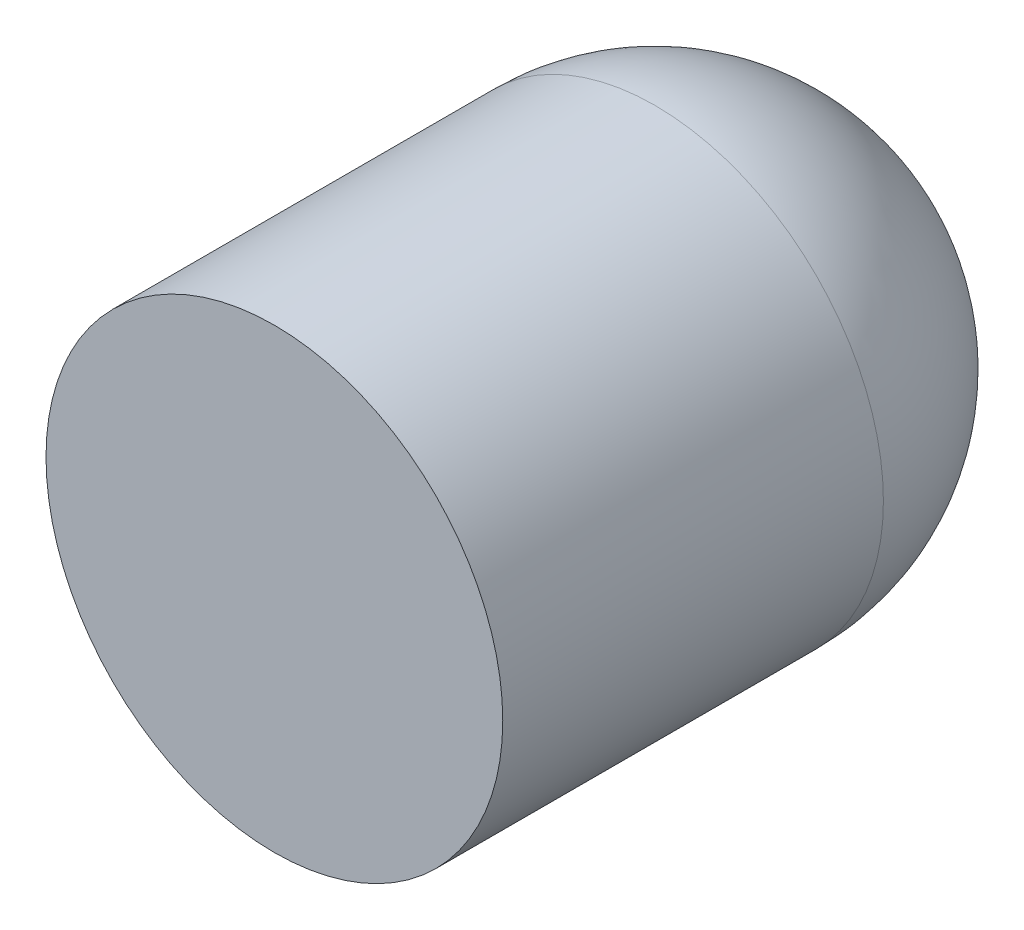
from build123d import *

# Parameters (mm, degrees)
SKETCH2_R           = 76.2
BOSS_EXTRUDE1_DEPTH = 127


with BuildPart() as part:
    # Sketch1 → Revolve1 (revolve)
    with BuildSketch(Plane(origin=(0, 0, 0), x_dir=(0, 0, -1), z_dir=(1, 0, 0))):
        with BuildLine():
            Line((0, 76.2), (0, 0))
            Line((0, 0), (76.2, 0))
            add(Edge.make_bspline(
                [(0, 76.2), (0.287944884, 76.2), (0.860935356, 76.196716581), (1.864342831, 76.181941173), (3.056742983, 76.142545193), (4.287082763, 76.083463947), (5.508891921, 76.004712705), (6.730383481, 75.906311819), (7.949881153, 75.788286725), (9.167455218, 75.650667955), (10.38259245, 75.493491096), (12.504429683, 75.184276063), (16.123848875, 74.537362387), (21.192492735, 73.319441888), (27.595708707, 71.186234114), (33.763677683, 68.446155539), (39.134457186, 65.485368022), (43.752972968, 62.467064928), (47.677395379, 59.525816294), (51.404659756, 56.338421916), (54.919362146, 52.918054668), (58.206955742, 49.278870811), (61.25386435, 45.435899511), (64.047473293, 41.405048095), (66.576228489, 37.202991876), (68.829674485, 32.847108438), (70.798494807, 28.355417823), (72.474543345, 23.746515844), (73.927049128, 18.77902819), (75.348535247, 12.282660226), (76.002027801, 6.89169127), (76.200000083, 2.697678666), (76.2, 0)],
                knots=[0.059945898, 0.059945898, 0.059945898, 0.059945898, 0.059945898, 0.069568544, 0.07919119, 0.088813837, 0.098436483, 0.108059133, 0.117681783, 0.127304433, 0.136927083, 0.14654973, 0.156172377, 0.194662964, 0.252398856, 0.310134737, 0.367870571, 0.406361217, 0.444851757, 0.483342319, 0.521832903, 0.560323383, 0.598814121, 0.637304319, 0.675795381, 0.714285651, 0.752775951, 0.791265715, 0.829756113, 0.868245067, 0.91525226, 1, 1, 1, 1, 1], degree=4))
        make_face()
    revolve(axis=Axis((0, 0, -480.06), (0, 0, 1)))

    # Sketch2 → Boss-Extrude1 (add)
    with BuildSketch(Plane.XY):
        Circle(SKETCH2_R)
    extrude(amount=BOSS_EXTRUDE1_DEPTH)


solid = part.part
